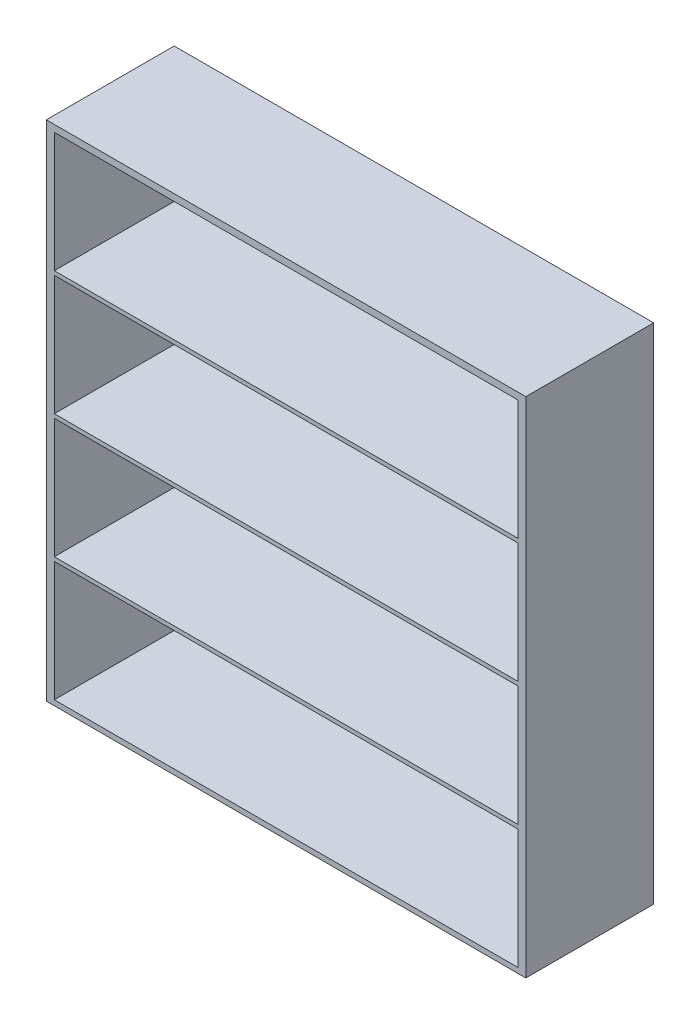
from build123d import *

# Parameters (mm, degrees)
SKETCH1_W           = 60
SKETCH1_H           = 63
BOSS_EXTRUDE1_DEPTH = 16
SKETCH3_W           = 58
SKETCH3_H           = 15
CUT_EXTRUDE1_DEPTH  = 15


with BuildPart() as part:
    # Sketch1 → Boss-Extrude1 (new body)
    with BuildSketch(Plane.XY):
        with Locations((30, 31.5)):
            Rectangle(SKETCH1_W, SKETCH1_H)
    extrude(amount=BOSS_EXTRUDE1_DEPTH)

    # Sketch3 → Cut-Extrude1 (cut)
    with BuildSketch(Plane.XY.offset(16)):
        with Locations((30, 8.15)):
            Rectangle(SKETCH3_W, SKETCH3_H)
        with Locations((30, 23.65)):
            Rectangle(SKETCH3_W, SKETCH3_H)
        with Locations((30, 39.15)):
            Rectangle(SKETCH3_W, SKETCH3_H)
        with Locations((30, 54.65)):
            Rectangle(SKETCH3_W, SKETCH3_H)
    extrude(amount=-CUT_EXTRUDE1_DEPTH, mode=Mode.SUBTRACT)


solid = part.part
